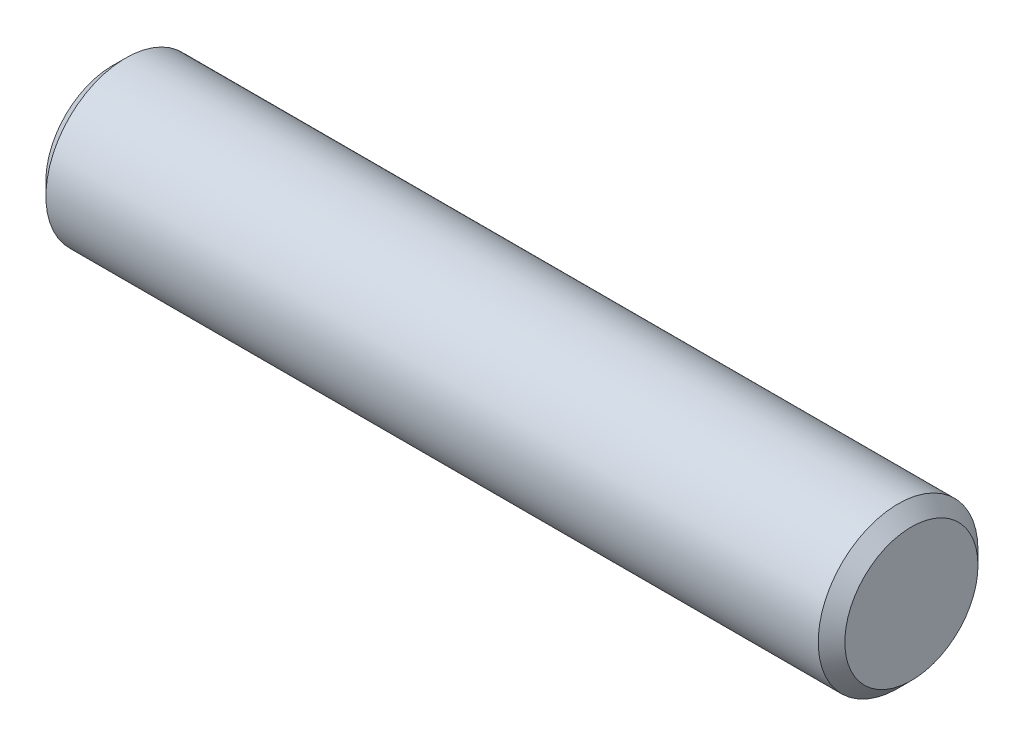
from build123d import *

# Parameters (mm, degrees)
SKETCH_1_R      = 3
EXTRUDE_1_DEPTH = 15
CHAMFER_1_SIZE  = 0.5


with BuildPart() as part:
    # Эскиз1 → Бобышка-Вытянуть1 (new, symmetric)
    with BuildSketch(Plane(origin=(0, 0, 0), x_dir=(0, 0, -1), z_dir=(1, 0, 0))):
        Circle(SKETCH_1_R)
    extrude(amount=EXTRUDE_1_DEPTH, both=True)

    # Фаска1
    chamfer_1_edges = [part.edges().sort_by_distance(p)[0] for p in [
        (-15, 0, 3),
        (15, 0, 3),
    ]]
    chamfer(chamfer_1_edges, length=CHAMFER_1_SIZE)


solid = part.part
